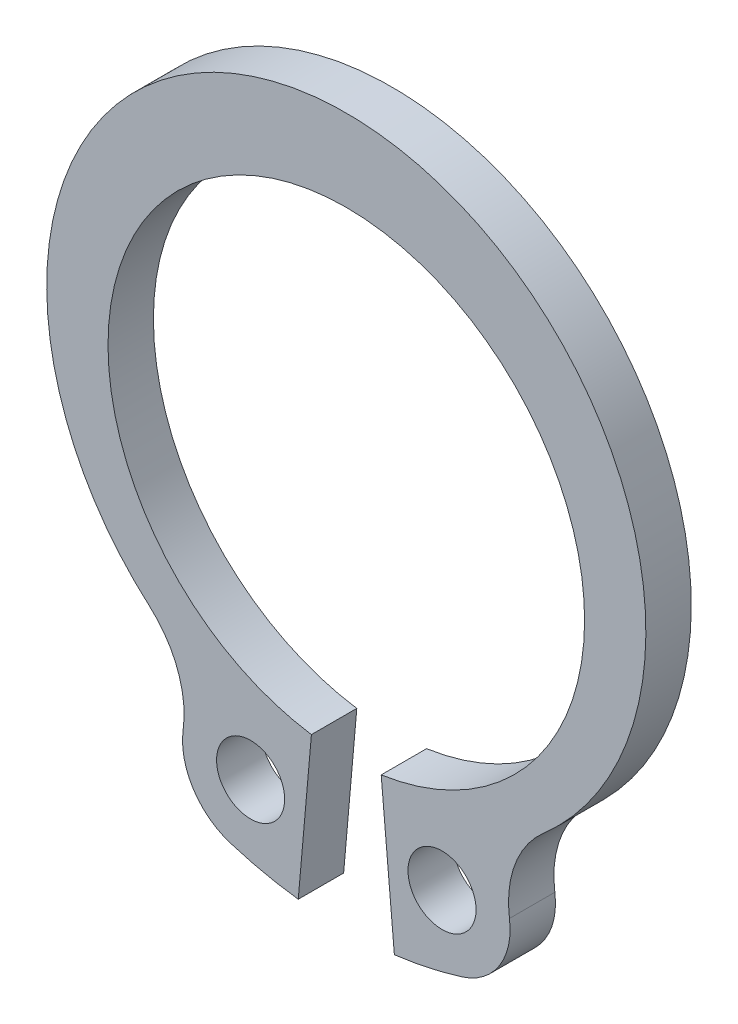
from build123d import *

# Parameters (mm, degrees)
ESQUISSE1_R          = 0.75
BASE_EXTRUSION_DEPTH = 1


with BuildPart() as part:
    # Esquisse1 → Base-Extrusion (new body)
    with BuildSketch(Plane.XY):
        with BuildLine():
            Line((0.768639364, -5.193427917), (1.058921586, -8.480635886))
            ThreePointArc((1.058921586, -8.480635886), (1.81541267, -8.351453574), (2.557265456, -8.154930615))
            ThreePointArc((2.557265456, -8.154930615), (3.375091505, -7.527139269), (3.594515939, -6.519759332))
            ThreePointArc((3.594515939, -6.519759332), (3.716376435, -5.425266349), (4.343048041, -4.519701572))
            ThreePointArc((4.343048041, -4.519701572), (0, 7.05), (-4.343048041, -4.519701572))
            ThreePointArc((-4.343048041, -4.519701572), (-3.716376435, -5.425266349), (-3.594515939, -6.519759332))
            ThreePointArc((-3.594515939, -6.519759332), (-3.375091505, -7.527139269), (-2.557265456, -8.154930615))
            ThreePointArc((-2.557265456, -8.154930615), (-1.81541267, -8.351453574), (-1.058921586, -8.480635886))
            Line((-1.058921586, -8.480635886), (-0.768639364, -5.193427917))
            ThreePointArc((-0.768639364, -5.193427917), (0, 5.25), (0.768639364, -5.193427917))
        make_face()
        with Locations((2.108438165, -6.723653541)):
            Circle(ESQUISSE1_R, mode=Mode.SUBTRACT)
        with Locations(Location((-2.108438165, -6.723653541, 0), (0, 0, 180))):
            Circle(ESQUISSE1_R, mode=Mode.SUBTRACT)
    extrude(amount=BASE_EXTRUSION_DEPTH)


solid = part.part
